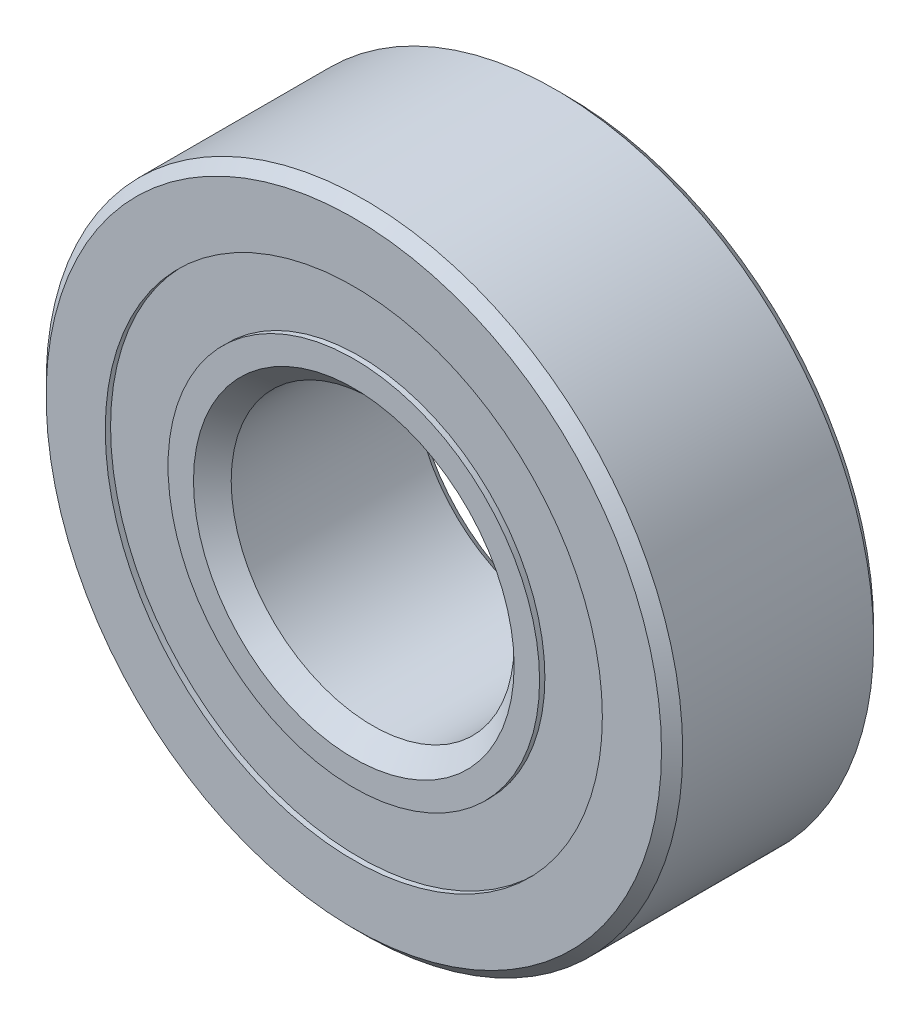
from build123d import *

# Parameters (mm, degrees)
CIRPATTERN1_COUNT = 10
SKETCH5_W         = 2.248094269
SKETCH5_H         = 2.817301638


with BuildPart() as part:
    # Sketch1 → Revolve1 (revolve)
    with BuildSketch(Plane(origin=(0, 0, 0), x_dir=(0, 0, -1), z_dir=(1, 0, 0))):
        with BuildLine():
            Line((4.28625, 14.2875), (-4.28625, 14.2875))
            Line((-4.28625, 14.2875), (-4.7625, 13.81125))
            Line((-4.7625, 13.81125), (-4.7625, 11.156112637))
            Line((-4.7625, 11.156112637), (-2.116666667, 11.156112637))
            ThreePointArc((-2.116666667, 11.156112637), (0, 12.595030731), (2.116666667, 11.156112637))
            Line((2.116666667, 11.156112637), (4.7625, 11.156112637))
            Line((4.7625, 11.156112637), (4.7625, 13.81125))
            Line((4.7625, 13.81125), (4.28625, 14.2875))
        make_face()
    revolve(axis=Axis((0, 0, 4.7625), (0, 0, -1)))


with BuildPart() as body_2:
    # Sketch3 → Revolve3 (revolve)
    with BuildSketch(Plane(origin=(0, 0, 0), x_dir=(0, 0, -1), z_dir=(1, 0, 0))):
        with BuildLine():
            Line((-4.524375, 8.100685999), (-3.619923636, 7.196234635))
            Line((-3.619923636, 7.196234635), (0, 7.196234635))
            Line((0, 7.196234635), (0, 8.042469269))
            ThreePointArc((0, 8.042469269), (1.279722925, 8.436261434), (2.116666667, 9.481387363))
            Line((2.116666667, 9.481387363), (4.7625, 9.481387363))
            Line((4.7625, 9.481387363), (4.7625, 6.82625))
            Line((4.7625, 6.82625), (4.28625, 6.35))
            Line((4.28625, 6.35), (-3.916265365, 6.35))
            Line((-3.916265365, 6.35), (-4.7625, 7.196234635))
            Line((-4.7625, 7.196234635), (-4.7625, 8.338810999))
            Line((-4.7625, 8.338810999), (-4.524375, 8.338810999))
            Line((-4.524375, 8.338810999), (-4.524375, 8.100685999))
        make_face()
    revolve(axis=Axis((0, 0, 4.7625), (0, 0, -1)))


with BuildPart() as body_3:
    # Sketch4 → Revolve4 (revolve)
    with BuildSketch(Plane(origin=(0, 0, 0), x_dir=(0, 0, -1), z_dir=(1, 0, 0))):
        with BuildLine():
            Line((-2.276280731, 10.31875), (2.276280731, 10.31875))
            ThreePointArc((2.276280731, 10.31875), (0, 12.595030731), (-2.276280731, 10.31875))
        make_face()
    revolve(axis=Axis((0, 10.31875, 2.276280731), (0, 0, -1)))


with BuildPart() as cirpattern1_1:
    # CirPattern1: pattern copy
    add(body_3.part.rotate(Axis((0, 0, -4.7625), (0, 0, 1)), 1 * 360 / CIRPATTERN1_COUNT))


with BuildPart() as cirpattern1_2:
    # CirPattern1: pattern copy
    add(body_3.part.rotate(Axis((0, 0, -4.7625), (0, 0, 1)), 2 * 360 / CIRPATTERN1_COUNT))


with BuildPart() as cirpattern1_3:
    # CirPattern1: pattern copy
    add(body_3.part.rotate(Axis((0, 0, -4.7625), (0, 0, 1)), 3 * 360 / CIRPATTERN1_COUNT))


with BuildPart() as cirpattern1_4:
    # CirPattern1: pattern copy
    add(body_3.part.rotate(Axis((0, 0, -4.7625), (0, 0, 1)), 4 * 360 / CIRPATTERN1_COUNT))


with BuildPart() as cirpattern1_5:
    # CirPattern1: pattern copy
    add(body_3.part.rotate(Axis((0, 0, -4.7625), (0, 0, 1)), 5 * 360 / CIRPATTERN1_COUNT))


with BuildPart() as cirpattern1_6:
    # CirPattern1: pattern copy
    add(body_3.part.rotate(Axis((0, 0, -4.7625), (0, 0, 1)), 6 * 360 / CIRPATTERN1_COUNT))


with BuildPart() as cirpattern1_7:
    # CirPattern1: pattern copy
    add(body_3.part.rotate(Axis((0, 0, -4.7625), (0, 0, 1)), 7 * 360 / CIRPATTERN1_COUNT))


with BuildPart() as cirpattern1_8:
    # CirPattern1: pattern copy
    add(body_3.part.rotate(Axis((0, 0, -4.7625), (0, 0, 1)), 8 * 360 / CIRPATTERN1_COUNT))


with BuildPart() as cirpattern1_9:
    # CirPattern1: pattern copy
    add(body_3.part.rotate(Axis((0, 0, -4.7625), (0, 0, 1)), 9 * 360 / CIRPATTERN1_COUNT))


with BuildPart() as body_13:
    # Sketch5 → Revolve5 (revolve)
    with BuildSketch(Plane(origin=(0, 0, 0), x_dir=(0, 0, -1), z_dir=(1, 0, 0))):
        with Locations((-3.400327865, 9.747461818)):
            Rectangle(SKETCH5_W, SKETCH5_H)
        with Locations((3.400327865, 9.747461818)):
            Rectangle(SKETCH5_W, SKETCH5_H)
    revolve(axis=Axis((0, 0, 4.7625), (0, 0, -1)))


solid = Compound([part.part, body_2.part, body_3.part, cirpattern1_1.part, cirpattern1_2.part, cirpattern1_3.part, cirpattern1_4.part, cirpattern1_5.part, cirpattern1_6.part, cirpattern1_7.part, cirpattern1_8.part, cirpattern1_9.part, body_13.part])
